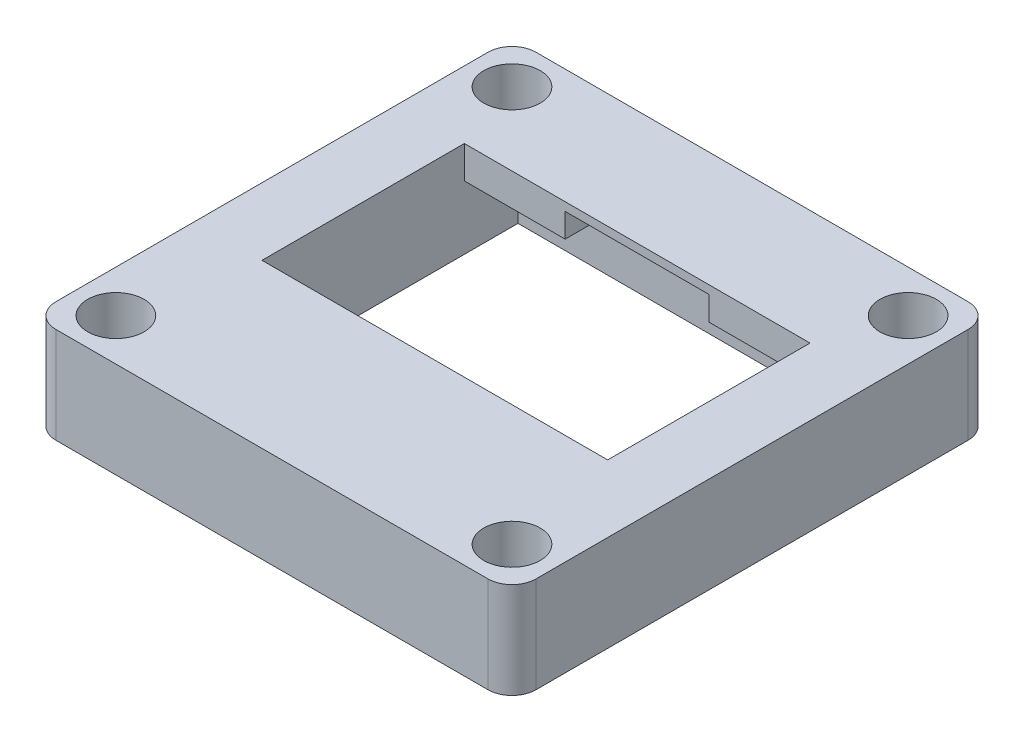
from build123d import *

# Parameters (mm, degrees)
SKETCH_1_W             = 40
SKETCH_1_H             = 40
EXTRUDE_644_DEPTH      = 8
SKETCH_2_W             = 28.8
SKETCH_2_H             = 29.8
CUT_EXTRUDE_826_DEPTH  = 5.3
SKETCH_3_W             = 28.8
SKETCH_3_H             = 20.86
CUT_EXTRUDE_1017_DEPTH = 29.776552955
SKETCH_4_W             = 12
SKETCH_4_H             = 4.47
CUT_EXTRUDE_1234_DEPTH = 2
SKETCH_5_W             = 28.8
SKETCH_5_H             = 0.5
EXTRUDE_1465_DEPTH     = 4
SKETCH_7_R             = 1.25
CUT_EXTRUDE_1704_DEPTH = 30.393876913
FILLET_1_R             = 2
SKETCH_8_R             = 2.35
CUT_EXTRUDE_2246_DEPTH = 4


with BuildPart() as part:
    # Эскиз1 → Extrude 644 (new body)
    with BuildSketch(Plane(origin=(0, 0, 0), x_dir=(1, 0, 0), z_dir=(0, 1, 0))):
        Rectangle(SKETCH_1_W, SKETCH_1_H)
    extrude(amount=EXTRUDE_644_DEPTH)

    # Эскиз2 → Cut-Extrude 826 (cut)
    with BuildSketch(Plane.XZ):
        Rectangle(SKETCH_2_W, SKETCH_2_H)
    extrude(amount=-CUT_EXTRUDE_826_DEPTH, mode=Mode.SUBTRACT)

    # Эскиз3 → Cut-Extrude 1017 (cut, through all)
    with BuildSketch(Plane.XZ.offset(-5.3)):
        Rectangle(SKETCH_3_W, SKETCH_3_H)
    extrude(amount=-CUT_EXTRUDE_1017_DEPTH, mode=Mode.SUBTRACT)

    # Эскиз4 → Cut-Extrude 1234 (cut)
    with BuildSketch(Plane.XZ.offset(-5.3)):
        with Locations((0, 12.665)):
            Rectangle(SKETCH_4_W, SKETCH_4_H)
        with Locations((0, -12.665)):
            Rectangle(SKETCH_4_W, SKETCH_4_H)
    extrude(amount=-CUT_EXTRUDE_1234_DEPTH, mode=Mode.SUBTRACT)

    # Эскиз5 → Extrude 1465 (add)
    with BuildSketch(Plane(origin=(0, 0, 10.43), x_dir=(-1, 0, 0), z_dir=(0, 0, -1))):
        with Locations((0, 7.75)):
            Rectangle(SKETCH_5_W, SKETCH_5_H)
    extrude(amount=EXTRUDE_1465_DEPTH)

    # Эскиз7 → Cut-Extrude 1704 (cut, through all)
    with BuildSketch(Plane.XZ):
        with Locations(Location((-16.5, 16.5, 0), (0, 0, 270))):
            Circle(SKETCH_7_R)
        with Locations(Location((16.5, 16.5, 0), (0, 0, 270))):
            Circle(SKETCH_7_R)
        with Locations(Location((16.5, -16.5, 0), (0, 0, 270))):
            Circle(SKETCH_7_R)
        with Locations(Location((-16.5, -16.5, 0), (0, 0, 270))):
            Circle(SKETCH_7_R)
    extrude(amount=-CUT_EXTRUDE_1704_DEPTH, mode=Mode.SUBTRACT)

    # Скругление1
    fillet_1_edges = [part.edges().sort_by_distance(p)[0] for p in [
        (20, 4, 20),
        (-20, 4, 20),
        (-20, 4, -20),
        (20, 4, -20),
    ]]
    fillet(fillet_1_edges, radius=FILLET_1_R)

    # Эскиз8 → Cut-Extrude 2246 (cut)
    with BuildSketch(Plane(origin=(0, 8, 0), x_dir=(1, 0, 0), z_dir=(0, 1, 0))):
        with Locations(Location((-16.5, 16.5, 0), (0, 0, 270))):
            Circle(SKETCH_8_R)
        with Locations(Location((-16.5, -16.5, 0), (0, 0, 270))):
            Circle(SKETCH_8_R)
        with Locations(Location((16.5, -16.5, 0), (0, 0, 270))):
            Circle(SKETCH_8_R)
        with Locations(Location((16.5, 16.5, 0), (0, 0, 270))):
            Circle(SKETCH_8_R)
    extrude(amount=-CUT_EXTRUDE_2246_DEPTH, mode=Mode.SUBTRACT)


solid = part.part
